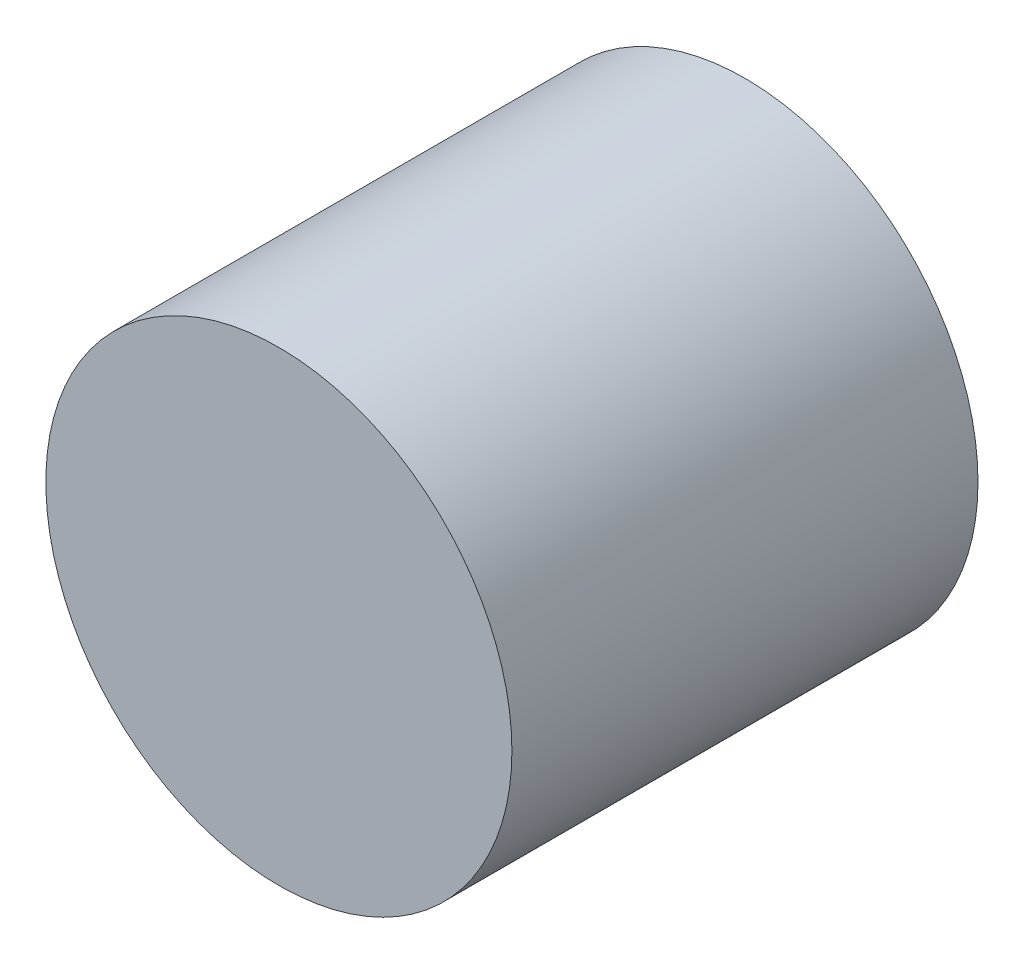
from build123d import *

# Parameters (mm, degrees)
SKETCH2_R      = 7.9375
CYLINDER_DEPTH = 15.875


with BuildPart() as part:
    # Sketch2 → cylinder (new body)
    with BuildSketch(Plane.XY):
        Circle(SKETCH2_R)
    extrude(amount=CYLINDER_DEPTH)


solid = part.part
